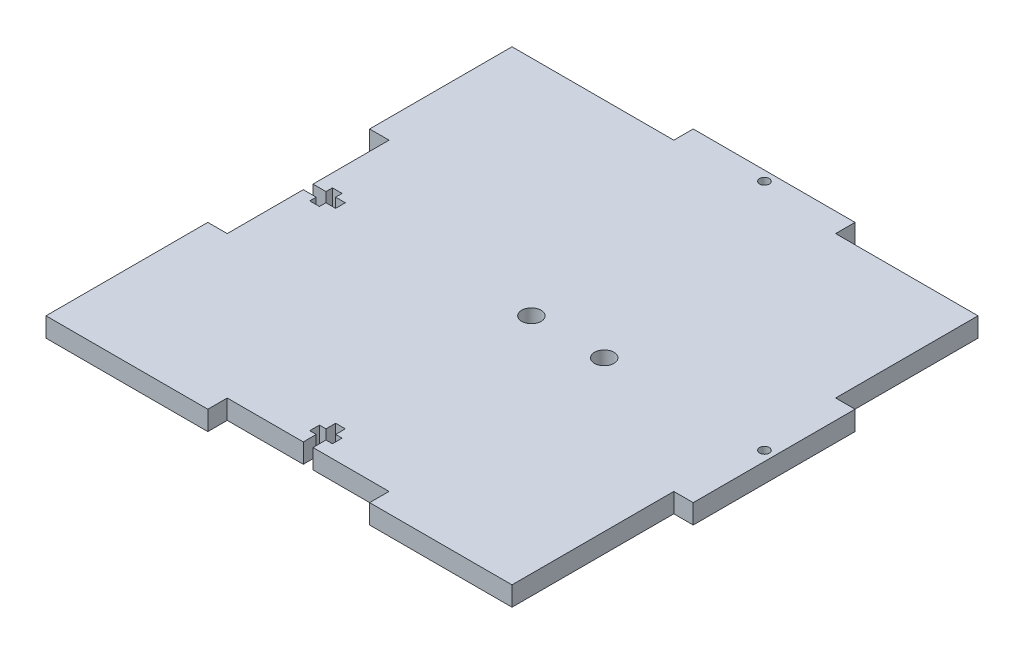
from build123d import *

# Parameters (mm, degrees)
SKETCH1_R           = 3
SKETCH1_R_2         = 1.5
BOSS_EXTRUDE1_DEPTH = 6


with BuildPart() as part:
    # Sketch1 → Boss-Extrude1 (new body)
    with BuildSketch(Plane(origin=(0, 0, 0), x_dir=(1, 0, 0), z_dir=(0, 1, 0))):
        Polygon((-72, 72), (-72, 28), (-66, 28), (-66, 4.5), (-62, 4.5), (-62, 6.5), (-59, 6.5), (-59, 4.5), (-56, 4.5), (-56, 1.5), (-59, 1.5), (-59, -0.5), (-62, -0.5), (-62, 1.5), (-66, 1.5), (-66, -22), (-72, -22), (-72, -72), (-22, -72), (-22, -66), (1.5, -66), (1.5, -62), (-0.5, -62), (-0.5, -59), (1.5, -59), (1.5, -56), (4.5, -56), (4.5, -59), (6.5, -59), (6.5, -62), (4.5, -62), (4.5, -66), (28, -66), (28, -72), (72, -72), (72, -22), (78, -22), (78, 28), (72, 28), (72, 72), (28, 72), (28, 78), (-22, 78), (-22, 72), align=None)
        with Locations(Location((3, 3, 0), (0, 0, 270))):
            Circle(SKETCH1_R, mode=Mode.SUBTRACT)
        with Locations(Location((25.5, 3, 0), (0, 0, 270))):
            Circle(SKETCH1_R, mode=Mode.SUBTRACT)
        with Locations(Location((3, 75, 0), (0, 0, 270))):
            Circle(SKETCH1_R_2, mode=Mode.SUBTRACT)
        with Locations(Location((75, 3, 0), (0, 0, 270))):
            Circle(SKETCH1_R_2, mode=Mode.SUBTRACT)
    extrude(amount=BOSS_EXTRUDE1_DEPTH)


solid = part.part
